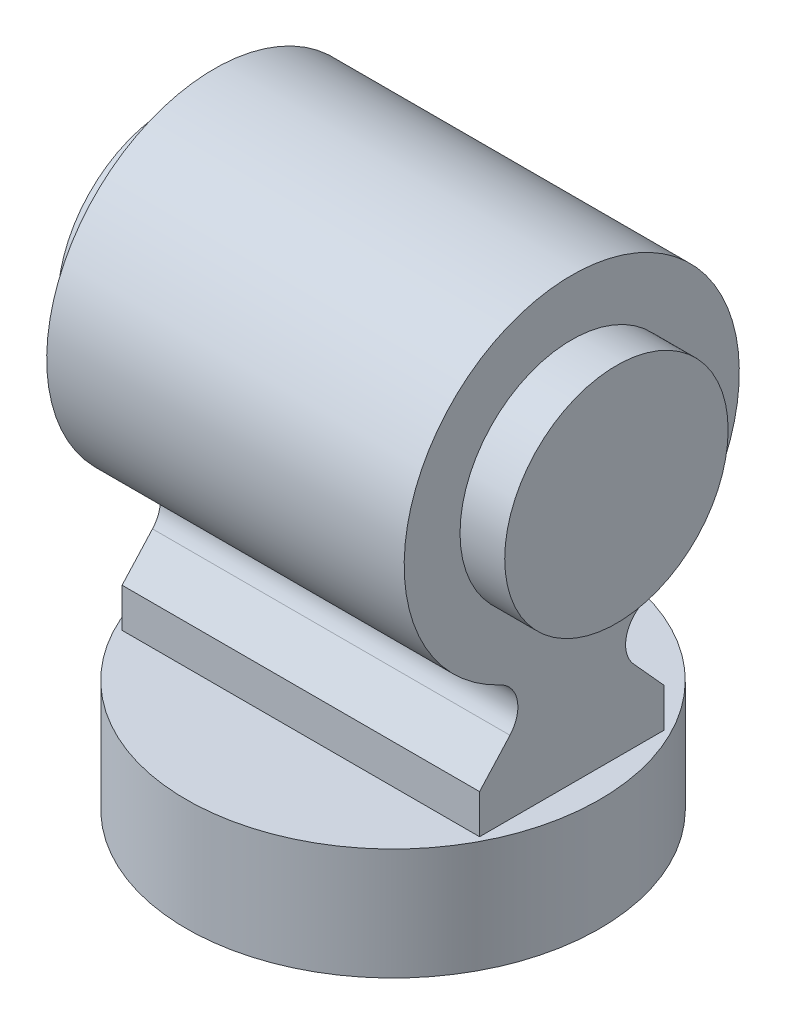
from build123d import *

# Parameters (mm, degrees)
BOSS_EXTRUDE1_DEPTH      = 32
BOSS_EXTRUDE1_DEPTH_BACK = 32
SKETCH3_R                = 20
BOSS_EXTRUDE2_DEPTH      = 8
BOSS_EXTRUDE3_START      = 8
SKETCH4_R                = 20
BOSS_EXTRUDE3_DEPTH      = 8
SKETCH5_R                = 37
BOSS_EXTRUDE4_DEPTH      = 20


with BuildPart() as part:
    # Sketch2 → Boss-Extrude1 (new, two sides: drawn at the far end of the back side and taken through both)
    with BuildSketch(Plane(origin=(0, 0, 0), x_dir=(0, 0, -1), z_dir=(1, 0, 0)).offset(-BOSS_EXTRUDE1_DEPTH_BACK)):
        with BuildLine():
            Line((-11.058503278, -35.806497408), (-16.5, -41.82))
            Line((-16.5, -41.82), (-16.5, -48.82))
            Line((-16.5, -48.82), (16.5, -48.82))
            Line((16.5, -48.82), (16.5, -41.82))
            Line((16.5, -41.82), (11.058503278, -35.806497408))
            ThreePointArc((11.058503278, -35.806497408), (9.747712726, -31.031847175), (12.79921149, -27.132640587))
            ThreePointArc((12.79921149, -27.132640587), (0, 30), (-12.79921149, -27.132640587))
            ThreePointArc((-12.79921149, -27.132640587), (-9.747712726, -31.031847175), (-11.058503278, -35.806497408))
        make_face()
    extrude(amount=BOSS_EXTRUDE1_DEPTH + BOSS_EXTRUDE1_DEPTH_BACK)

    # Sketch3 → Boss-Extrude2 (add)
    with BuildSketch(Plane(origin=(32, 0, 0), x_dir=(0, 0, -1), z_dir=(1, 0, 0))):
        Circle(SKETCH3_R)
    extrude(amount=BOSS_EXTRUDE2_DEPTH)

    # Sketch4 → Boss-Extrude3 (add)
    with BuildSketch(Plane.ZY.offset(32).offset(BOSS_EXTRUDE3_START)):
        Circle(SKETCH4_R)
    extrude(amount=-BOSS_EXTRUDE3_DEPTH)

    # Sketch5 → Boss-Extrude4 (add)
    with BuildSketch(Plane.XZ.offset(48.82)):
        Circle(SKETCH5_R)
    extrude(amount=BOSS_EXTRUDE4_DEPTH)


solid = part.part
